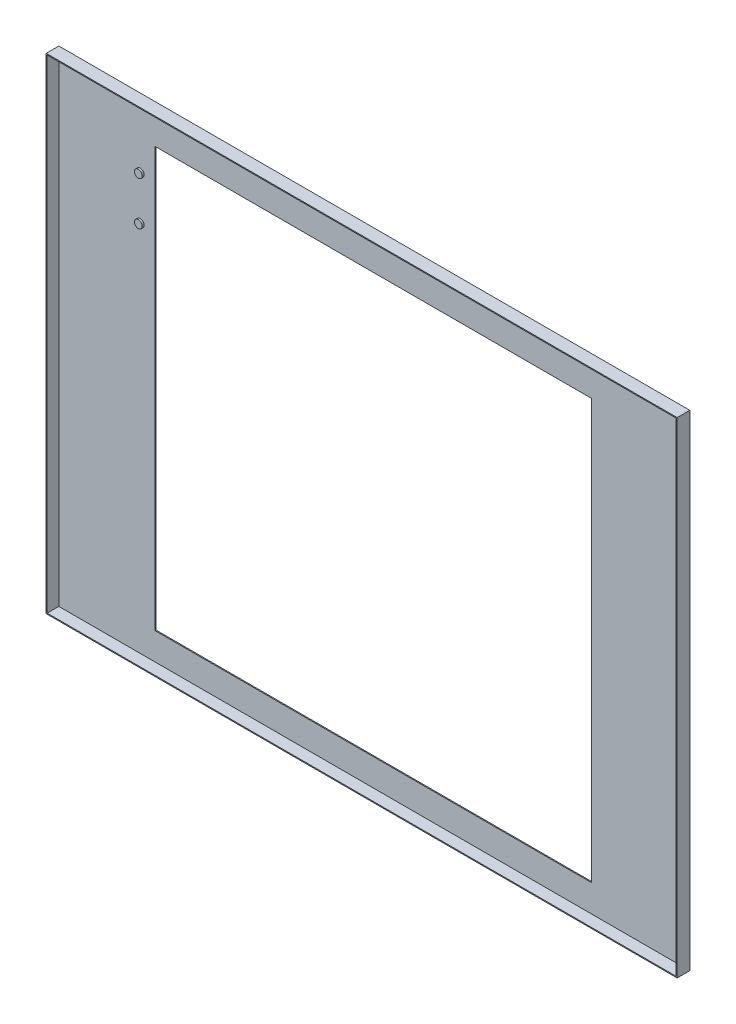
from build123d import *

# Parameters (mm, degrees)
SKETCH1_W           = 650
SKETCH1_H           = 500
SKETCH1_W_2         = 450
SKETCH1_H_2         = 422
BOSS_EXTRUDE1_DEPTH = 13
SKETCH2_W           = 450
SKETCH2_H           = 10
CUT_EXTRUDE1_DEPTH  = 13
SHELL1_T            = -1
SKETCH3_R           = 4
BOSS_EXTRUDE2_DEPTH = 2
LPATTERN1_COUNT     = 2
LPATTERN1_PITCH     = 45


with BuildPart() as part:
    # Sketch1 → Boss-Extrude1 (new body)
    with BuildSketch(Plane.XY):
        Rectangle(SKETCH1_W, SKETCH1_H)
        Rectangle(SKETCH1_W_2, SKETCH1_H_2, mode=Mode.SUBTRACT)
    extrude(amount=BOSS_EXTRUDE1_DEPTH)

    # Sketch2 → Cut-Extrude1 (cut)
    with BuildSketch(Plane(origin=(0, 0, 0), x_dir=(-1, 0, 0), z_dir=(0, 0, -1))):
        with Locations((0, -216)):
            Rectangle(SKETCH2_W, SKETCH2_H)
    extrude(amount=-CUT_EXTRUDE1_DEPTH, mode=Mode.SUBTRACT)

    # Shell1
    shell1_openings = [part.faces().sort_by_distance(p)[0] for p in [
        (0, -241.799390267, 13),
        (-225, -5, 6.5),
        (225, -5, 6.5),
        (0, 211, 6.5),
        (0, -221, 6.5),
    ]]
    offset(amount=SHELL1_T, openings=shell1_openings, kind=Kind.INTERSECTION)

    # Sketch3 → Boss-Extrude2 (add)
    with BuildSketch(Plane.XY.offset(1)):
        with Locations((-240.106920594, 180)):
            Circle(SKETCH3_R)
    boss_extrude2 = extrude(amount=BOSS_EXTRUDE2_DEPTH)

    # LPattern1: Boss-Extrude2 ×2
    with Locations(*[(0, -i * LPATTERN1_PITCH, 0) for i in range(1, LPATTERN1_COUNT)]):
        add(boss_extrude2)


solid = part.part
